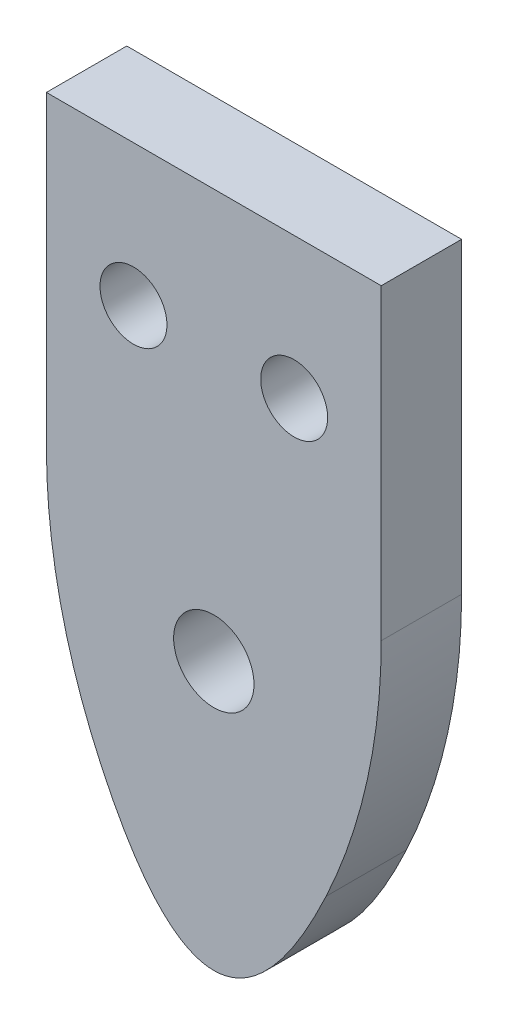
from build123d import *

# Parameters (mm, degrees)
ESQUISSE1_R        = 1.25
ESQUISSE1_R_2      = 1.5
BOSS_EXTRU_1_DEPTH = 3
CONG_3_R           = 22
CONG_4_R           = 22


with BuildPart() as part:
    # Esquisse1 → Boss.-Extru.1 (new body)
    with BuildSketch(Plane.XY):
        with BuildLine():
            Line((-8.227794557, 2.434117026), (4.272205443, 2.434117026))
            Line((4.272205443, 2.434117026), (4.272205443, -12.832640321))
            add(Edge.make_bspline(
                [(-8.227794557, -12.832640321), (-1.977794557, -32.832640321), (4.272205443, -12.832640321)],
                knots=[0, 0, 0, 1, 1, 1], degree=2))
            Line((-8.227794557, -12.832640321), (-8.227794557, 2.434117026))
        make_face()
        with Locations((-4.977794557, -2.832640321)):
            Circle(ESQUISSE1_R, mode=Mode.SUBTRACT)
        with Locations((1.022205443, -2.832640321)):
            Circle(ESQUISSE1_R, mode=Mode.SUBTRACT)
        with Locations((-1.977794557, -12.832640321)):
            Circle(ESQUISSE1_R_2, mode=Mode.SUBTRACT)
    extrude(amount=BOSS_EXTRU_1_DEPTH)

    # Congé3
    cong_3_edges = [part.edges().sort_by_distance(p)[0] for p in [
        (4.272205443, -12.832640321, 1.5),
    ]]
    fillet(cong_3_edges, radius=CONG_3_R)

    # Congé4
    cong_4_edges = [part.edges().sort_by_distance(p)[0] for p in [
        (-8.227794557, -12.832640321, 1.5),
    ]]
    fillet(cong_4_edges, radius=CONG_4_R)


solid = part.part
